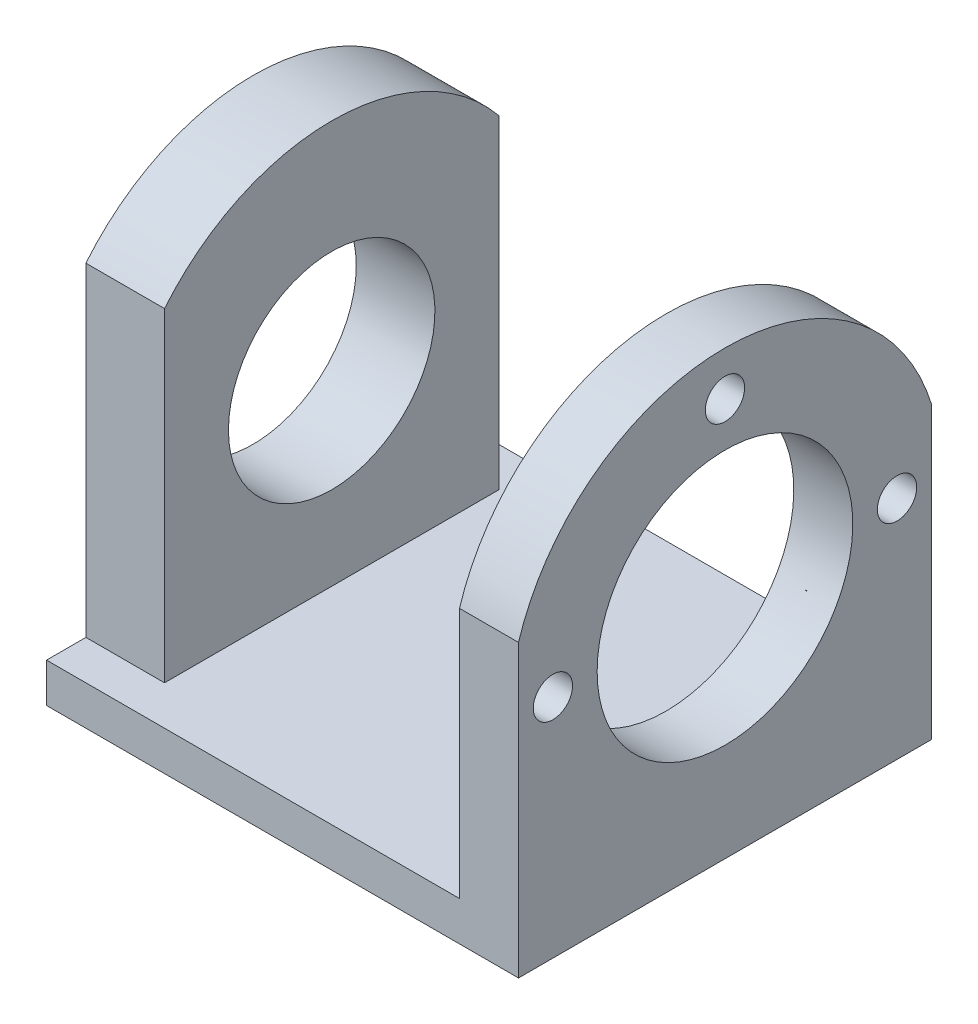
from build123d import *

# Parameters (mm, degrees)
SKETCH_1_W               = 48
SKETCH_1_H               = 42
EXTRUDE_1_DEPTH          = 45
CUT_EXTRUDE_1_DEPTH      = 56.154328933
CUT_EXTRUDE_1_DEPTH_BACK = 56.154328933
SKETCH_2_W               = 34
SKETCH_2_H               = 41
CUT_EXTRUDE_2_REACH      = 71.065
SKETCH_3_R               = 10.5
CUT_EXTRUDE_3_REACH      = 67.038
SKETCH_4_R               = 13
CUT_EXTRUDE_4_REACH      = 71.065
SKETCH_5_R               = 2
CUT_EXTRUDE_5_DEPTH      = 70.065186599
CUT_EXTRUDE_6_REACH      = 71.065
HOLE_WIZARD_M3_1_D       = 2.5
HOLE_WIZARD_M3_1_DEPTH   = 16.5
HOLE_WIZARD_M3_1_TIP     = 0.751075774


with BuildPart() as part:
    # 草图1 → 凸台-拉伸1 (new body)
    with BuildSketch(Plane(origin=(0, 0, 0), x_dir=(1, 0, 0), z_dir=(0, 1, 0))):
        Rectangle(SKETCH_1_W, SKETCH_1_H)
    extrude(amount=EXTRUDE_1_DEPTH)

    # 草图2 → 切除-拉伸1 (cut, two sides: drawn at the far end of the back side and taken through both)
    with BuildSketch(Plane.XY.offset(-CUT_EXTRUDE_1_DEPTH_BACK)):
        with Locations((1, 24.5)):
            Rectangle(SKETCH_2_W, SKETCH_2_H)
    extrude(amount=CUT_EXTRUDE_1_DEPTH + CUT_EXTRUDE_1_DEPTH_BACK, mode=Mode.SUBTRACT)

    # 草图3 → 切除-拉伸2 (cut, up to next)
    with BuildSketch(Plane.ZY.offset(24), mode=Mode.PRIVATE) as cut_extrude_2_sk1:
        with Locations((0, 23)):
            Circle(SKETCH_3_R)
    cut_extrude_2_tool1 = extrude(cut_extrude_2_sk1.sketch, amount=-CUT_EXTRUDE_2_REACH, mode=Mode.PRIVATE) & part.part
    add(cut_extrude_2_tool1.solids().sort_by_distance((-24, 23, 0))[0], mode=Mode.SUBTRACT)

    # 草图4 → 切除-拉伸3 (cut, up to next)
    with BuildSketch(Plane.ZY.offset(-18), mode=Mode.PRIVATE) as cut_extrude_3_sk1:
        with Locations(Location((0, 23, 0), (0, 0, 270))):
            Circle(SKETCH_4_R)
    cut_extrude_3_tool1 = extrude(cut_extrude_3_sk1.sketch, amount=-CUT_EXTRUDE_3_REACH, mode=Mode.PRIVATE) & part.part
    add(cut_extrude_3_tool1.solids().sort_by_distance((18, 23, 0))[0], mode=Mode.SUBTRACT)

    # 草图5 → 切除-拉伸4 (cut, up to next)
    with BuildSketch(Plane(origin=(24, 0, 0), x_dir=(0, 0, -1), z_dir=(1, 0, 0)), mode=Mode.PRIVATE) as cut_extrude_4_sk1:
        with Locations((17.5, 23)):
            Circle(SKETCH_5_R)
    cut_extrude_4_tool1 = extrude(cut_extrude_4_sk1.sketch, amount=-CUT_EXTRUDE_4_REACH, mode=Mode.PRIVATE) & part.part
    # 草图5 → 切除-拉伸4 (cut, up to next)
    with BuildSketch(Plane(origin=(24, 0, 0), x_dir=(0, 0, -1), z_dir=(1, 0, 0)), mode=Mode.PRIVATE) as cut_extrude_4_sk2:
        with Locations((-17.5, 23)):
            Circle(SKETCH_5_R)
    cut_extrude_4_tool2 = extrude(cut_extrude_4_sk2.sketch, amount=-CUT_EXTRUDE_4_REACH, mode=Mode.PRIVATE) & part.part
    # 草图5 → 切除-拉伸4 (cut, up to next)
    with BuildSketch(Plane(origin=(24, 0, 0), x_dir=(0, 0, -1), z_dir=(1, 0, 0)), mode=Mode.PRIVATE) as cut_extrude_4_sk3:
        with Locations((0, 40.5)):
            Circle(SKETCH_5_R)
    cut_extrude_4_tool3 = extrude(cut_extrude_4_sk3.sketch, amount=-CUT_EXTRUDE_4_REACH, mode=Mode.PRIVATE) & part.part
    add(cut_extrude_4_tool1.solids().sort_by_distance((24, 23, -17.5))[0], mode=Mode.SUBTRACT)
    add(cut_extrude_4_tool2.solids().sort_by_distance((24, 23, 17.5))[0], mode=Mode.SUBTRACT)
    add(cut_extrude_4_tool3.solids().sort_by_distance((24, 40.5, 0))[0], mode=Mode.SUBTRACT)

    # 草图6 → 切除-拉伸5 (cut, through all)
    with BuildSketch(Plane.ZY.offset(24)):
        with BuildLine():
            ThreePointArc((0, 45), (13.033348619, 40.723764379), (21, 29.557438524))
            Line((21, 29.557438524), (21, 45))
            Line((21, 45), (0, 45))
        make_face()
        with BuildLine():
            ThreePointArc((-21, 29.557438524), (-13.033348619, 40.723764379), (0, 45))
            Line((0, 45), (-21, 45))
            Line((-21, 45), (-21, 29.557438524))
        make_face()
    extrude(amount=-CUT_EXTRUDE_5_DEPTH, mode=Mode.SUBTRACT)

    # 草图7 → 切除-拉伸6 (cut, up to next)
    with BuildSketch(Plane.ZY.offset(24), mode=Mode.PRIVATE) as cut_extrude_6_sk1:
        with BuildLine():
            Line((-17, 36.964240044), (-17, 4))
            Line((-17, 4), (-21, 4))
            Line((-21, 4), (-21, 29.557438524))
            ThreePointArc((-21, 29.557438524), (-19.357561241, 33.453938149), (-17, 36.964240044))
        make_face()
    cut_extrude_6_tool1 = extrude(cut_extrude_6_sk1.sketch, amount=-CUT_EXTRUDE_6_REACH, mode=Mode.PRIVATE) & part.part
    # 草图7 → 切除-拉伸6 (cut, up to next)
    with BuildSketch(Plane.ZY.offset(24), mode=Mode.PRIVATE) as cut_extrude_6_sk2:
        with BuildLine():
            Line((21, 29.557438524), (21, 4))
            Line((21, 4), (17, 4))
            Line((17, 4), (17, 36.964240044))
            ThreePointArc((17, 36.964240044), (19.357561241, 33.453938149), (21, 29.557438524))
        make_face()
    cut_extrude_6_tool2 = extrude(cut_extrude_6_sk2.sketch, amount=-CUT_EXTRUDE_6_REACH, mode=Mode.PRIVATE) & part.part
    add(cut_extrude_6_tool1.solids().sort_by_distance((-24, 18.988652, -18.919979))[0], mode=Mode.SUBTRACT)
    add(cut_extrude_6_tool2.solids().sort_by_distance((-24, 18.988652, 18.919979))[0], mode=Mode.SUBTRACT)

    # M3 螺纹孔1
    with Locations(Plane(origin=(21, 0, -12.5), x_dir=(0, 0, -1), z_dir=(0, -1, 0))):
        with Locations((0, 0), (-25, 0), (-25, -42), (0, -42)):
            Hole(HOLE_WIZARD_M3_1_D / 2, depth=HOLE_WIZARD_M3_1_DEPTH)
            with Locations((0, 0, -(HOLE_WIZARD_M3_1_DEPTH + HOLE_WIZARD_M3_1_TIP / 2))):  # 118° drill point
                Cone(0, HOLE_WIZARD_M3_1_D / 2, HOLE_WIZARD_M3_1_TIP, mode=Mode.SUBTRACT)


solid = part.part
